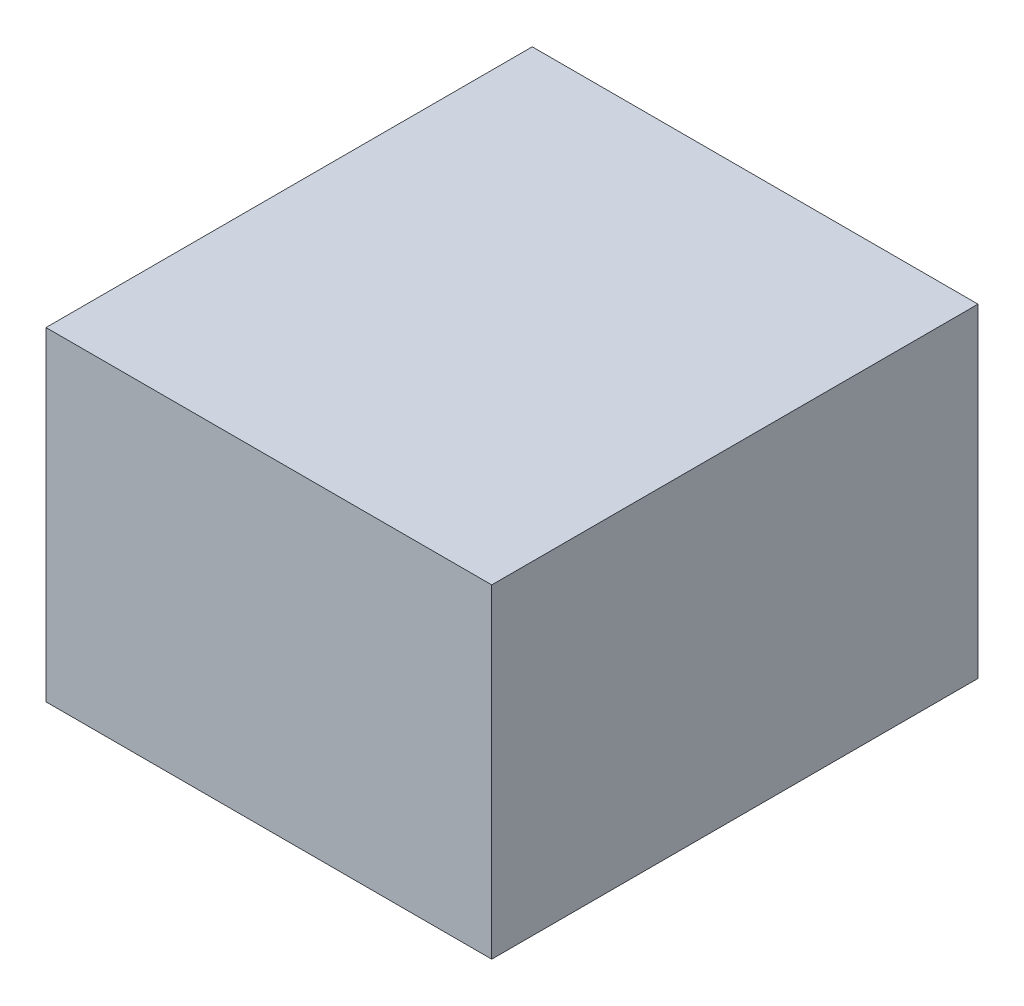
from build123d import *

# Parameters (mm, degrees)
SKETCH1_W           = 69.85
SKETCH1_H           = 76.2
BOSS_EXTRUDE1_DEPTH = 50.8


with BuildPart() as part:
    # Sketch1 → Boss-Extrude1 (new body)
    with BuildSketch(Plane(origin=(0, 0, 0), x_dir=(1, 0, 0), z_dir=(0, 1, 0))):
        with Locations((-10.795, -1.524)):
            Rectangle(SKETCH1_W, SKETCH1_H)
    extrude(amount=BOSS_EXTRUDE1_DEPTH)


solid = part.part
